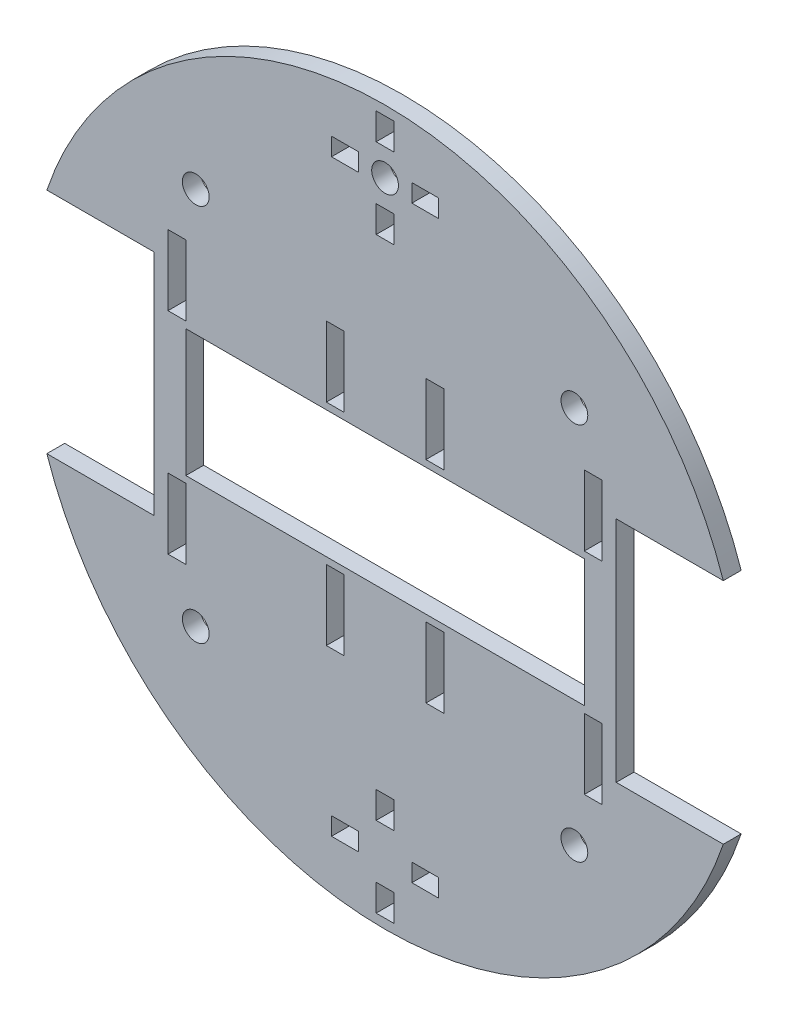
from build123d import *

# Parameters (mm, degrees)
BOSS_EXTRUDE1_DEPTH     = 6.35
CUT_EXTRUDE1_DEPTH      = 176.071306912
CUT_EXTRUDE1_DEPTH_BACK = 176.071306912
SKETCH2_W               = 6.35
SKETCH2_H               = 24.999999975
SKETCH2_H_2             = 24.999999974
CUT_EXTRUDE2_DEPTH      = 176.071306912
CUT_EXTRUDE2_DEPTH_BACK = 176.071306912
SKETCH5_W               = 141.771062044
SKETCH5_H               = 45.249999988
CUT_EXTRUDE3_DEPTH      = 176.071306912
CUT_EXTRUDE3_DEPTH_BACK = 176.071306912
SKETCH6_R               = 4.7625
CUT_EXTRUDE4_DEPTH      = 176.071306912
CUT_EXTRUDE4_DEPTH_BACK = 176.071306912
SKETCH7_R               = 4.7625
CUT_EXTRUDE5_DEPTH      = 176.071306912
CUT_EXTRUDE5_DEPTH_BACK = 176.071306912
SKETCH8_W               = 6.35
SKETCH8_H               = 9.525
SKETCH8_W_2             = 9.525
SKETCH8_H_2             = 6.35


with BuildPart() as part:
    # Sketch1 → Boss-Extrude1 (new body)
    with BuildSketch(Plane.XY):
        with BuildLine():
            Line((120.335530928, -40.599999953), (82.235530928, -40.599999953))
            Line((82.235530928, -40.599999953), (82.235530928, 40.599999953))
            Line((82.235530928, 40.599999953), (120.335530928, 40.599999953))
            ThreePointArc((120.335530928, 40.599999953), (0, 127), (-120.335530928, 40.599999953))
            Line((-120.335530928, 40.599999953), (-82.235530928, 40.599999953))
            Line((-82.235530928, 40.599999953), (-82.235530928, -40.599999953))
            Line((-82.235530928, -40.599999953), (-120.335530928, -40.599999953))
            ThreePointArc((-120.335530928, -40.599999953), (0, -127), (120.335530928, -40.599999953))
        make_face()
    extrude(amount=BOSS_EXTRUDE1_DEPTH)

    # Sketch2 → Cut-Extrude1 (cut, two sides: drawn at the far end of the back side and taken through both)
    with BuildSketch(Plane.XY.offset(6.35).offset(-CUT_EXTRUDE1_DEPTH_BACK)):
        with Locations((17.710530946, 37.499999962)):
            Rectangle(SKETCH2_W, SKETCH2_H)
        with Locations((-74.060531022, 37.499999962)):
            Rectangle(SKETCH2_W, SKETCH2_H)
        with Locations((-17.710530946, 37.499999962)):
            Rectangle(SKETCH2_W, SKETCH2_H)
        with Locations((74.060531022, 37.499999962)):
            Rectangle(SKETCH2_W, SKETCH2_H_2)
        with Locations((74.060531022, -37.499999962)):
            Rectangle(SKETCH2_W, SKETCH2_H_2)
        with Locations((17.710530946, -37.499999962)):
            Rectangle(SKETCH2_W, SKETCH2_H)
        with Locations((-17.710530946, -37.499999962)):
            Rectangle(SKETCH2_W, SKETCH2_H_2)
        with Locations((-74.060531022, -37.499999962)):
            Rectangle(SKETCH2_W, SKETCH2_H_2)
    extrude(amount=CUT_EXTRUDE1_DEPTH + CUT_EXTRUDE1_DEPTH_BACK, mode=Mode.SUBTRACT)

    # Sketch5 → Cut-Extrude2 (cut, two sides: drawn at the far end of the back side and taken through both)
    with BuildSketch(Plane.XY.offset(6.35).offset(-CUT_EXTRUDE2_DEPTH_BACK)):
        Rectangle(SKETCH5_W, SKETCH5_H)
    extrude(amount=CUT_EXTRUDE2_DEPTH + CUT_EXTRUDE2_DEPTH_BACK, mode=Mode.SUBTRACT)

    # Sketch6 → Cut-Extrude3 (cut, two sides: drawn at the far end of the back side and taken through both)
    with BuildSketch(Plane.XY.offset(6.35).offset(-CUT_EXTRUDE3_DEPTH_BACK)):
        with Locations((-67.351920908, 67.351920908)):
            Circle(SKETCH6_R)
        with Locations((67.351920908, 67.351920908)):
            Circle(SKETCH6_R)
        with Locations((67.351920908, -67.351920908)):
            Circle(SKETCH6_R)
        with Locations((-67.351920908, -67.351920908)):
            Circle(SKETCH6_R)
    extrude(amount=CUT_EXTRUDE3_DEPTH + CUT_EXTRUDE3_DEPTH_BACK, mode=Mode.SUBTRACT)

    # Sketch7 → Cut-Extrude4 (cut, two sides: drawn at the far end of the back side and taken through both)
    with BuildSketch(Plane.XY.offset(6.35).offset(-CUT_EXTRUDE4_DEPTH_BACK)):
        with Locations((0, 104.537500094)):
            Circle(SKETCH7_R)
    extrude(amount=CUT_EXTRUDE4_DEPTH + CUT_EXTRUDE4_DEPTH_BACK, mode=Mode.SUBTRACT)

    # Sketch8 → Cut-Extrude5 (cut, two sides: drawn at the far end of the back side and taken through both)
    with BuildSketch(Plane.XY.offset(6.35).offset(-CUT_EXTRUDE5_DEPTH_BACK)):
        with Locations((0, 118.825000094)):
            Rectangle(SKETCH8_W, SKETCH8_H)
        with Locations((0, 90.250000094)):
            Rectangle(SKETCH8_W, SKETCH8_H)
        with Locations((0, -90.250000094)):
            Rectangle(SKETCH8_W, SKETCH8_H)
        with Locations((0, -118.825000094)):
            Rectangle(SKETCH8_W, SKETCH8_H)
        with Locations((-14.2875, 104.683652736)):
            Rectangle(SKETCH8_W_2, SKETCH8_H_2)
        with Locations((14.2875, 104.683652736)):
            Rectangle(SKETCH8_W_2, SKETCH8_H_2)
        with Locations((14.2875, -104.683652736)):
            Rectangle(SKETCH8_W_2, SKETCH8_H_2)
        with Locations((-14.2875, -104.683652736)):
            Rectangle(SKETCH8_W_2, SKETCH8_H_2)
    extrude(amount=CUT_EXTRUDE5_DEPTH + CUT_EXTRUDE5_DEPTH_BACK, mode=Mode.SUBTRACT)


solid = part.part
